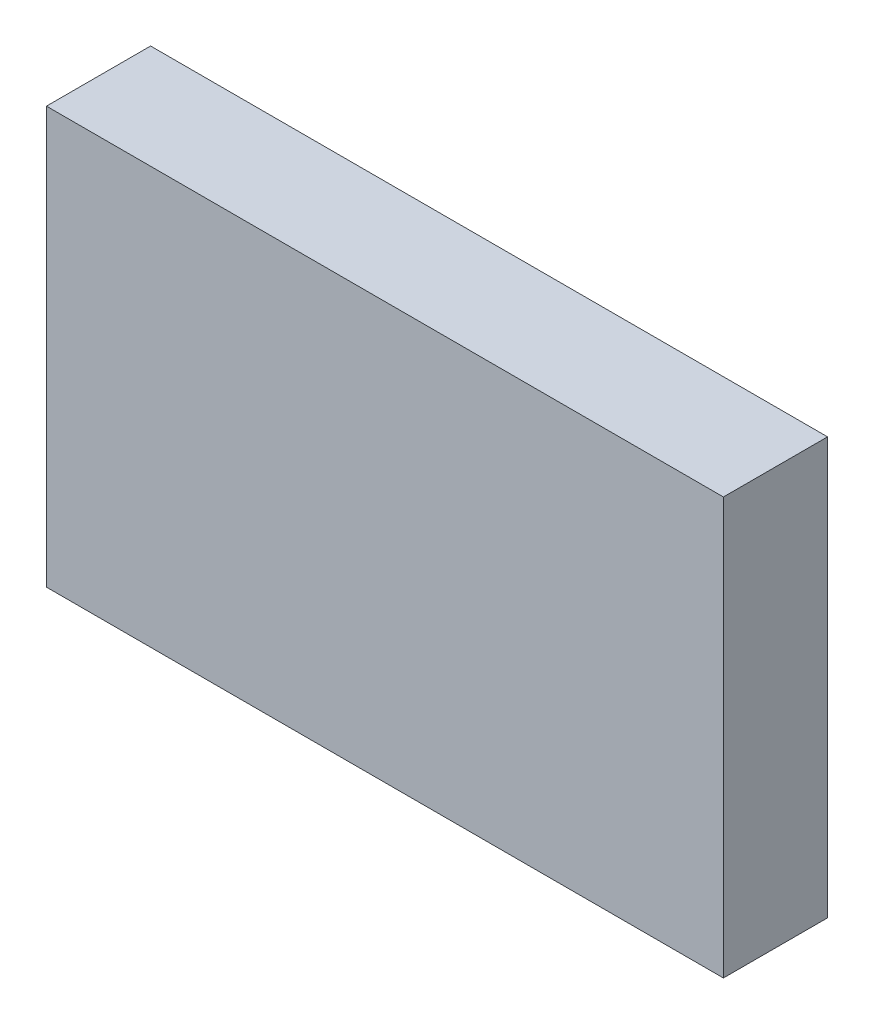
from build123d import *

# Parameters (mm, degrees)
SKETCH_1_W         = 13
SKETCH_1_H         = 8
BLOCKEXTRUDE_DEPTH = 2


with BuildPart() as part:
    # 草图1 → BlockExtrude (new body)
    with BuildSketch(Plane.XY):
        with Locations((6.5, 4)):
            Rectangle(SKETCH_1_W, SKETCH_1_H)
    extrude(amount=BLOCKEXTRUDE_DEPTH)


solid = part.part
